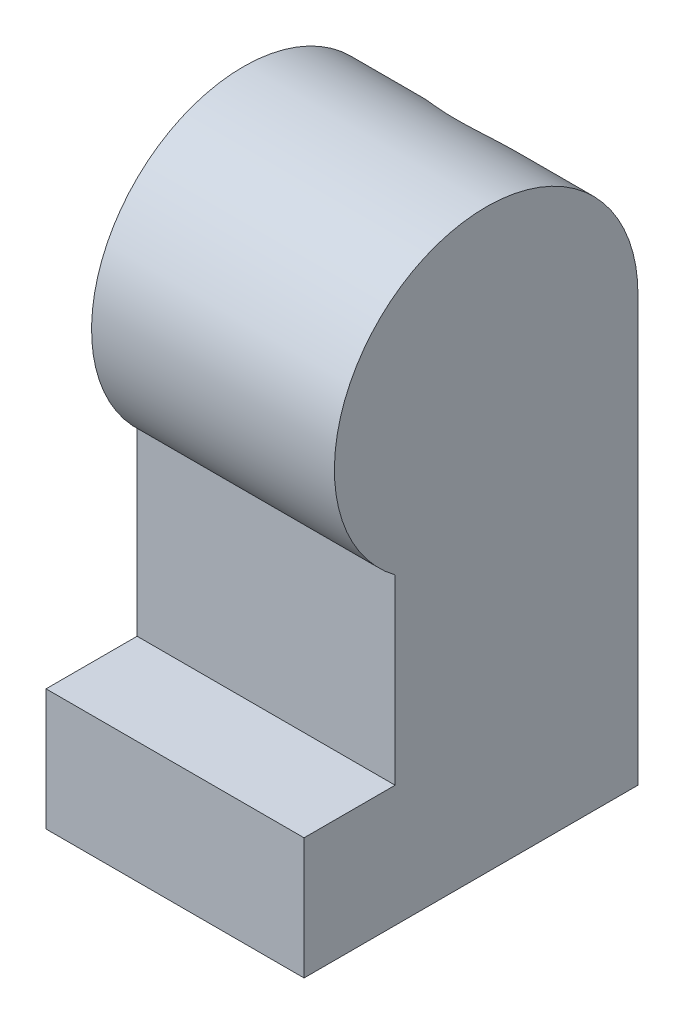
from build123d import *

# Parameters (mm, degrees)
BOSS_EXTRUDE4_DEPTH  = 6.746875
SKETCH6_R            = 3.96875
BOSS_EXTRUDE5_DEPTH  = 6.746875
SHELL2_T             = -0.79375
BOSS_EXTRUDE6_REACH  = 19.089
CUT_EXTRUDE2_START   = -0.396875
SKETCH11_R           = 3.96875
CUT_EXTRUDE2_DEPTH   = 0.396875
SKETCH13_R           = 3.96875
BOSS_EXTRUDE11_DEPTH = 6.35
SKETCH14_R           = 2.38125
CUT_EXTRUDE3_DEPTH   = 1.984375
CUT_EXTRUDE4_DEPTH   = 3.571875
SKETCH17_R           = 1.190625
CUT_EXTRUDE5_DEPTH   = 2.38125


with BuildPart() as part:
    # Sketch2 → Boss-Extrude4 (new body)
    with BuildSketch(Plane(origin=(0, 0, 0), x_dir=(0, 0, -1), z_dir=(1, 0, 0))):
        Polygon((-4.365625, 0), (4.365625, 0), (4.365625, 11.1125), (-1.984375, 11.1125), (-1.984375, 3.175), (-4.365625, 3.175), align=None)
    extrude(amount=BOSS_EXTRUDE4_DEPTH)

    # Sketch6 → Boss-Extrude5 (add)
    with BuildSketch(Plane(origin=(6.746875, 0, 0), x_dir=(0, 0, -1), z_dir=(1, 0, 0))):
        with Locations((0.396875, 11.1125)):
            Circle(SKETCH6_R)
    extrude(amount=-BOSS_EXTRUDE5_DEPTH)

    # Shell2
    shell2_openings = [part.faces().sort_by_distance(p)[0] for p in [
        (3.3734375, 0, 0),
    ]]
    offset(amount=SHELL2_T, openings=shell2_openings, kind=Kind.INTERSECTION)

    # Sketch7 → Boss-Extrude6 (add, up to next)
    with BuildSketch(Plane.XZ, mode=Mode.PRIVATE) as boss_extrude6_sk1:
        Polygon((5.953125, 3.571875), (5.953125, 2.38125), (1.190625, 2.38125), (1.190625, -2.38125), (5.953125, -2.38125), (5.953125, -3.571875), (0.79375, -3.571875), (0.79375, 3.571875), align=None)
    boss_extrude6_tool1 = extrude(boss_extrude6_sk1.sketch, amount=-BOSS_EXTRUDE6_REACH, mode=Mode.PRIVATE) - part.part
    add(boss_extrude6_tool1.solids().sort_by_distance((5.865004, 0, 2.976562))[0])

    # Sketch11 → Cut-Extrude2 (cut)
    with BuildSketch(Plane.ZY.offset(CUT_EXTRUDE2_START)):
        with Locations((-0.396875, 11.1125)):
            Circle(SKETCH11_R)
    extrude(amount=CUT_EXTRUDE2_DEPTH, mode=Mode.SUBTRACT)

    # Sketch13 → Boss-Extrude11 (add)
    with BuildSketch(Plane(origin=(6.746875, 0, 0), x_dir=(0, 0, -1), z_dir=(1, 0, 0))):
        with Locations((0.396875, 11.1125)):
            Circle(SKETCH13_R)
    extrude(amount=-BOSS_EXTRUDE11_DEPTH)

    # Sketch14 → Cut-Extrude3 (cut)
    with BuildSketch(Plane(origin=(0, 0, -4.365625), x_dir=(-1, 0, 0), z_dir=(0, 0, -1))):
        with Locations(Location((-3.571875, 3.96875, 0), (0, 0, 90))):
            Circle(SKETCH14_R)
        with Locations(Location((-3.571875, 11.90625, 0), (0, 0, 180))):
            Circle(SKETCH14_R)
    extrude(amount=-CUT_EXTRUDE3_DEPTH, mode=Mode.SUBTRACT)

    # Sketch16 → Cut-Extrude4 (cut)
    with BuildSketch(Plane(origin=(0, 0, -2.38125), x_dir=(-1, 0, 0), z_dir=(0, 0, -1))):
        with BuildLine():
            Line((-2.778125, 9.66118597), (-2.778125, 14.15131403))
            ThreePointArc((-2.778125, 14.15131403), (-5.953125, 11.90625), (-2.778125, 9.66118597))
        make_face()
    extrude(amount=-CUT_EXTRUDE4_DEPTH, mode=Mode.SUBTRACT)

    # Sketch17 → Cut-Extrude5 (cut)
    with BuildSketch(Plane.ZY.offset(-0.396875)):
        with Locations((-0.396875, 11.1125)):
            Circle(SKETCH17_R)
    extrude(amount=-CUT_EXTRUDE5_DEPTH, mode=Mode.SUBTRACT)


solid = part.part
